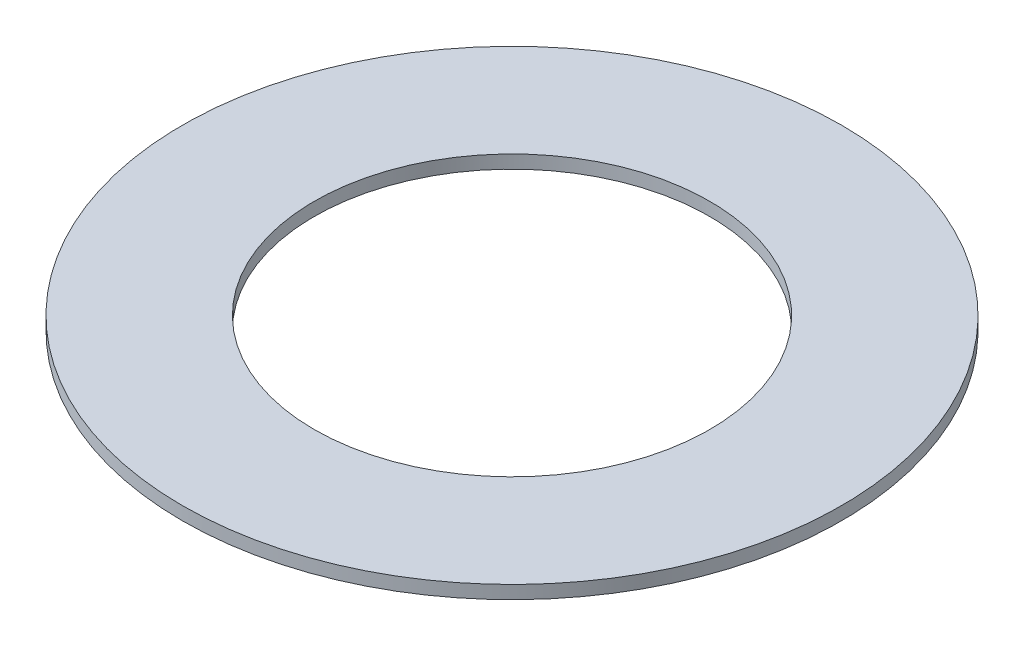
from build123d import *

# Parameters (mm, degrees)
SKETCH1_R           = 5
SKETCH1_R_2         = 3
BOSS_EXTRUDE1_DEPTH = 0.2


with BuildPart() as part:
    # Sketch1 → Boss-Extrude1 (new body)
    with BuildSketch(Plane(origin=(0, 0, 0), x_dir=(1, 0, 0), z_dir=(0, 1, 0))):
        with Locations(Location((0, 0, 0), (0, 0, 270))):
            Circle(SKETCH1_R)
        with Locations(Location((0, 0, 0), (0, 0, 270))):
            Circle(SKETCH1_R_2, mode=Mode.SUBTRACT)
    extrude(amount=BOSS_EXTRUDE1_DEPTH)


solid = part.part
